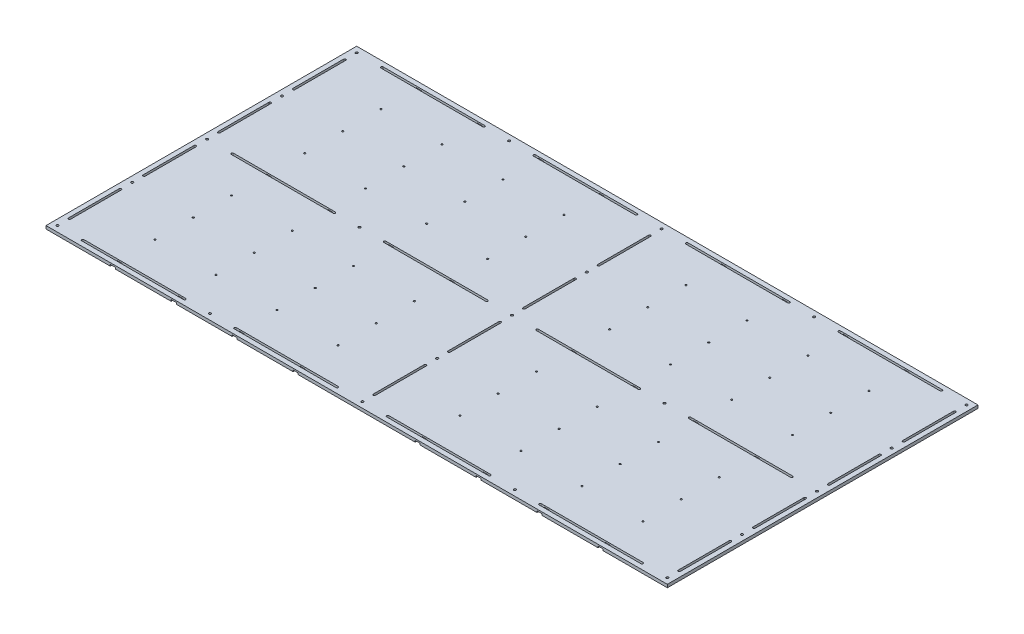
from build123d import *

# Parameters (mm, degrees)
SKETCH1_W                  = 2440
SKETCH1_H                  = 1220
BOSS_EXTRUDE1_DEPTH        = 12
SKETCH3_W                  = 20
SKETCH3_H                  = 1220
CUT_EXTRUDE1_DEPTH         = 6
M8_CLEARANCE_HOLE1_D       = 9
CUT_EXTRUDE2_DEPTH         = 1365.054251121
F_6_5_6_5_DIAMETER_HOLE1_D = 6.5
F_9_0_9_DIAMETER_HOLE1_D   = 9


with BuildPart() as part:
    # Sketch1 → Boss-Extrude1 (new body)
    with BuildSketch(Plane(origin=(0, 0, 0), x_dir=(1, 0, 0), z_dir=(0, 1, 0))):
        Rectangle(SKETCH1_W, SKETCH1_H)
    extrude(amount=BOSS_EXTRUDE1_DEPTH)

    # Sketch3 → Cut-Extrude1 (cut)
    with BuildSketch(Plane.XZ):
        with Locations((-958, 0)):
            Rectangle(SKETCH3_W, SKETCH3_H)
        with Locations((-718.5, 0)):
            Rectangle(SKETCH3_W, SKETCH3_H)
        with Locations((-479, 0)):
            Rectangle(SKETCH3_W, SKETCH3_H)
        with Locations((-239.5, 0)):
            Rectangle(SKETCH3_W, SKETCH3_H)
        with Locations((239.5, 0)):
            Rectangle(SKETCH3_W, SKETCH3_H)
        with Locations((479, 0)):
            Rectangle(SKETCH3_W, SKETCH3_H)
        with Locations((718.5, 0)):
            Rectangle(SKETCH3_W, SKETCH3_H)
        with Locations((958, 0)):
            Rectangle(SKETCH3_W, SKETCH3_H)
    extrude(amount=-CUT_EXTRUDE1_DEPTH, mode=Mode.SUBTRACT)

    # M8 Clearance Hole1 (through all)
    with Locations(Plane(origin=(0, 12, 0), x_dir=(1, 0, 0), z_dir=(0, 1, 0))):
        with Locations((-1197.5, 587.5), (-1197.5, 293.75), (-1197.5, 0), (-1197.5, -293.75), (-1197.5, -587.5), (0, -587.5), (0, 0), (0, 587.5), (1197.5, 587.5), (1197.5, 293.75), (1197.5, 0), (1197.5, -293.75), (1197.5, -587.5), (0, -293.75), (0, 293.75), (598.75, 0), (-598.75, 0), (-598.75, -587.5), (-598.75, 587.5), (598.75, 587.5), (598.75, -587.5)):
            Hole(M8_CLEARANCE_HOLE1_D / 2)

    # Sketch8 → Cut-Extrude2 (cut, through all)
    with BuildSketch(Plane(origin=(0, 12, 0), x_dir=(1, 0, 0), z_dir=(0, 1, 0))):
        with BuildLine():
            Line((-1098.125, 591.75), (-698.125, 591.75))
            ThreePointArc((-698.125, 591.75), (-693.875, 587.5), (-698.125, 583.25))
            Line((-698.125, 583.25), (-1098.125, 583.25))
            ThreePointArc((-1098.125, 583.25), (-1102.375, 587.5), (-1098.125, 591.75))
        make_face()
        with BuildLine():
            Line((-99.375, 583.25), (-499.375, 583.25))
            ThreePointArc((-499.375, 583.25), (-503.625, 587.5), (-499.375, 591.75))
            Line((-499.375, 591.75), (-99.375, 591.75))
            ThreePointArc((-99.375, 591.75), (-95.125, 587.5), (-99.375, 583.25))
        make_face()
        with BuildLine():
            Line((-1201.75, 340.625), (-1201.75, 540.625))
            ThreePointArc((-1201.75, 540.625), (-1197.5, 544.875), (-1193.25, 540.625))
            Line((-1193.25, 540.625), (-1193.25, 340.625))
            ThreePointArc((-1193.25, 340.625), (-1197.5, 336.375), (-1201.75, 340.625))
        make_face()
        with BuildLine():
            Line((-1201.75, 46.875), (-1201.75, 246.875))
            ThreePointArc((-1201.75, 246.875), (-1197.5, 251.125), (-1193.25, 246.875))
            Line((-1193.25, 246.875), (-1193.25, 46.875))
            ThreePointArc((-1193.25, 46.875), (-1197.5, 42.625), (-1201.75, 46.875))
        make_face()
        with BuildLine():
            Line((-1201.75, -246.875), (-1201.75, -46.875))
            ThreePointArc((-1201.75, -46.875), (-1197.5, -42.625), (-1193.25, -46.875))
            Line((-1193.25, -46.875), (-1193.25, -246.875))
            ThreePointArc((-1193.25, -246.875), (-1197.5, -251.125), (-1201.75, -246.875))
        make_face()
        with BuildLine():
            Line((-1201.75, -540.625), (-1201.75, -340.625))
            ThreePointArc((-1201.75, -340.625), (-1197.5, -336.375), (-1193.25, -340.625))
            Line((-1193.25, -340.625), (-1193.25, -540.625))
            ThreePointArc((-1193.25, -540.625), (-1197.5, -544.875), (-1201.75, -540.625))
        make_face()
        with BuildLine():
            Line((-1098.125, -583.25), (-698.125, -583.25))
            ThreePointArc((-698.125, -583.25), (-693.875, -587.5), (-698.125, -591.75))
            Line((-698.125, -591.75), (-1098.125, -591.75))
            ThreePointArc((-1098.125, -591.75), (-1102.375, -587.5), (-1098.125, -583.25))
        make_face()
        with BuildLine():
            Line((-99.375, -591.75), (-499.375, -591.75))
            ThreePointArc((-499.375, -591.75), (-503.625, -587.5), (-499.375, -583.25))
            Line((-499.375, -583.25), (-99.375, -583.25))
            ThreePointArc((-99.375, -583.25), (-95.125, -587.5), (-99.375, -591.75))
        make_face()
        with BuildLine():
            Line((-99.375, -4.25), (-499.375, -4.25))
            ThreePointArc((-499.375, -4.25), (-503.625, 0), (-499.375, 4.25))
            Line((-499.375, 4.25), (-99.375, 4.25))
            ThreePointArc((-99.375, 4.25), (-95.125, 0), (-99.375, -4.25))
        make_face()
        with BuildLine():
            Line((-1098.125, 4.25), (-698.125, 4.25))
            ThreePointArc((-698.125, 4.25), (-693.875, 0), (-698.125, -4.25))
            Line((-698.125, -4.25), (-1098.125, -4.25))
            ThreePointArc((-1098.125, -4.25), (-1102.375, 0), (-1098.125, 4.25))
        make_face()
        with BuildLine():
            Line((1098.125, 591.75), (698.125, 591.75))
            ThreePointArc((698.125, 591.75), (693.875, 587.5), (698.125, 583.25))
            Line((698.125, 583.25), (1098.125, 583.25))
            ThreePointArc((1098.125, 583.25), (1102.375, 587.5), (1098.125, 591.75))
        make_face()
        with BuildLine():
            Line((99.375, 583.25), (499.375, 583.25))
            ThreePointArc((499.375, 583.25), (503.625, 587.5), (499.375, 591.75))
            Line((499.375, 591.75), (99.375, 591.75))
            ThreePointArc((99.375, 591.75), (95.125, 587.5), (99.375, 583.25))
        make_face()
        with BuildLine():
            Line((1201.75, 340.625), (1201.75, 540.625))
            ThreePointArc((1201.75, 540.625), (1197.5, 544.875), (1193.25, 540.625))
            Line((1193.25, 540.625), (1193.25, 340.625))
            ThreePointArc((1193.25, 340.625), (1197.5, 336.375), (1201.75, 340.625))
        make_face()
        with BuildLine():
            Line((1201.75, 46.875), (1201.75, 246.875))
            ThreePointArc((1201.75, 246.875), (1197.5, 251.125), (1193.25, 246.875))
            Line((1193.25, 246.875), (1193.25, 46.875))
            ThreePointArc((1193.25, 46.875), (1197.5, 42.625), (1201.75, 46.875))
        make_face()
        with BuildLine():
            Line((1201.75, -246.875), (1201.75, -46.875))
            ThreePointArc((1201.75, -46.875), (1197.5, -42.625), (1193.25, -46.875))
            Line((1193.25, -46.875), (1193.25, -246.875))
            ThreePointArc((1193.25, -246.875), (1197.5, -251.125), (1201.75, -246.875))
        make_face()
        with BuildLine():
            Line((1201.75, -540.625), (1201.75, -340.625))
            ThreePointArc((1201.75, -340.625), (1197.5, -336.375), (1193.25, -340.625))
            Line((1193.25, -340.625), (1193.25, -540.625))
            ThreePointArc((1193.25, -540.625), (1197.5, -544.875), (1201.75, -540.625))
        make_face()
        with BuildLine():
            Line((1098.125, -583.25), (698.125, -583.25))
            ThreePointArc((698.125, -583.25), (693.875, -587.5), (698.125, -591.75))
            Line((698.125, -591.75), (1098.125, -591.75))
            ThreePointArc((1098.125, -591.75), (1102.375, -587.5), (1098.125, -583.25))
        make_face()
        with BuildLine():
            Line((99.375, -591.75), (499.375, -591.75))
            ThreePointArc((499.375, -591.75), (503.625, -587.5), (499.375, -583.25))
            Line((499.375, -583.25), (99.375, -583.25))
            ThreePointArc((99.375, -583.25), (95.125, -587.5), (99.375, -591.75))
        make_face()
        with BuildLine():
            Line((99.375, -4.25), (499.375, -4.25))
            ThreePointArc((499.375, -4.25), (503.625, 0), (499.375, 4.25))
            Line((499.375, 4.25), (99.375, 4.25))
            ThreePointArc((99.375, 4.25), (95.125, 0), (99.375, -4.25))
        make_face()
        with BuildLine():
            Line((1098.125, 4.25), (698.125, 4.25))
            ThreePointArc((698.125, 4.25), (693.875, 0), (698.125, -4.25))
            Line((698.125, -4.25), (1098.125, -4.25))
            ThreePointArc((1098.125, -4.25), (1102.375, 0), (1098.125, 4.25))
        make_face()
        with BuildLine():
            Line((-4.25, 340.625), (-4.25, 540.625))
            ThreePointArc((-4.25, 540.625), (0, 544.875), (4.25, 540.625))
            Line((4.25, 540.625), (4.25, 340.625))
            ThreePointArc((4.25, 340.625), (0, 336.375), (-4.25, 340.625))
        make_face()
        with BuildLine():
            Line((-4.25, 46.875), (-4.25, 246.875))
            ThreePointArc((-4.25, 246.875), (0, 251.125), (4.25, 246.875))
            Line((4.25, 246.875), (4.25, 46.875))
            ThreePointArc((4.25, 46.875), (0, 42.625), (-4.25, 46.875))
        make_face()
        with BuildLine():
            Line((-4.25, -246.875), (-4.25, -46.875))
            ThreePointArc((-4.25, -46.875), (0, -42.625), (4.25, -46.875))
            Line((4.25, -46.875), (4.25, -246.875))
            ThreePointArc((4.25, -246.875), (0, -251.125), (-4.25, -246.875))
        make_face()
        with BuildLine():
            Line((-4.25, -540.625), (-4.25, -340.625))
            ThreePointArc((-4.25, -340.625), (0, -336.375), (4.25, -340.625))
            Line((4.25, -340.625), (4.25, -540.625))
            ThreePointArc((4.25, -540.625), (0, -544.875), (-4.25, -540.625))
        make_face()
    extrude(amount=-CUT_EXTRUDE2_DEPTH, mode=Mode.SUBTRACT)

    # Ø6.5 (6.5) Diameter Hole1 (through all)
    with Locations(Plane(origin=(0, 12, 0), x_dir=(1, 0, 0), z_dir=(0, 1, 0))):
        with Locations((-958, 443.75), (-958, 293.75), (-958, 143.75), (-958, -143.75), (-958, -293.75), (-958, -443.75), (-718.5, 443.75), (-718.5, 293.75), (-718.5, 143.75), (-718.5, -143.75), (-718.5, -293.75), (-718.5, -443.75), (-479, 443.75), (-479, 293.75), (-479, 143.75), (-479, -143.75), (-479, -293.75), (-479, -443.75), (-239.5, 443.75), (-239.5, 293.75), (-239.5, 143.75), (-239.5, -143.75), (-239.5, -293.75), (-239.5, -443.75), (239.5, 443.75), (239.5, 293.75), (239.5, 143.75), (239.5, -143.75), (239.5, -293.75), (239.5, -443.75), (479, 443.75), (479, 293.75), (479, 143.75), (479, -143.75), (479, -293.75), (479, -443.75), (718.5, 443.75), (718.5, 293.75), (718.5, 143.75), (718.5, -143.75), (718.5, -293.75), (718.5, -443.75), (958, 443.75), (958, 293.75), (958, 143.75), (958, -143.75), (958, -293.75), (958, -443.75)):
            Hole(F_6_5_6_5_DIAMETER_HOLE1_D / 2)

    # Ø9.0 (9) Diameter Hole1 (through all)
    with Locations(Plane(origin=(0, 12, 0), x_dir=(1, 0, 0), z_dir=(0, 1, 0))):
        with Locations((-1197.5, 293.75), (-1197.5, -293.75), (-598.75, -587.5), (598.75, -587.5), (1197.5, -293.75), (1197.5, 293.75), (598.75, 587.5), (-598.75, 587.5), (0, 293.75), (0, -293.75)):
            Hole(F_9_0_9_DIAMETER_HOLE1_D / 2)


solid = part.part
